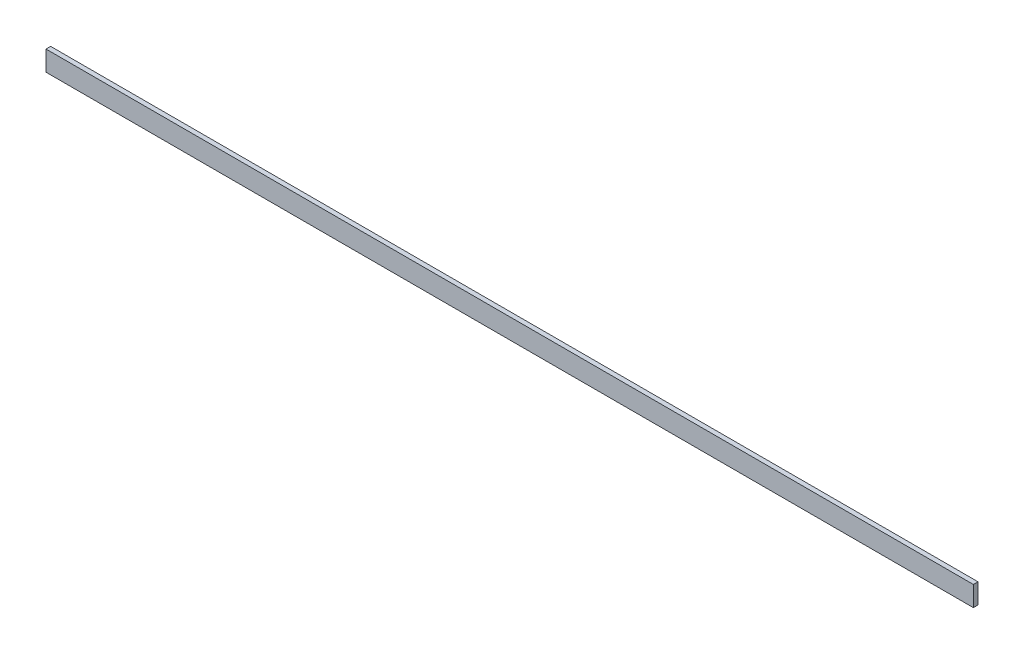
from build123d import *

# Parameters (mm, degrees)
SKETCH1_W           = 600
SKETCH1_H           = 13
BOSS_EXTRUDE1_DEPTH = 3


with BuildPart() as part:
    # Sketch1 → Boss-Extrude1 (new body)
    with BuildSketch(Plane.XY):
        Rectangle(SKETCH1_W, SKETCH1_H)
    extrude(amount=BOSS_EXTRUDE1_DEPTH)


solid = part.part
